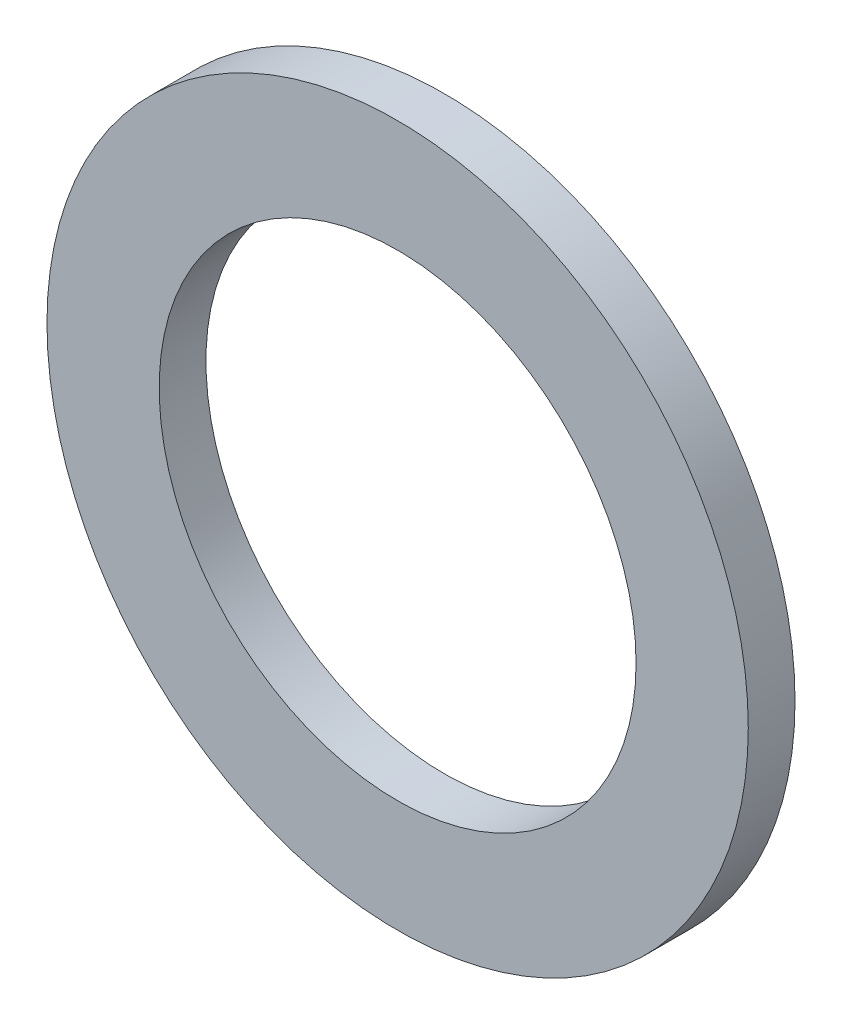
from build123d import *

# Parameters (mm, degrees)
ESQUISSE1_R        = 7.5
ESQUISSE1_R_2      = 5.1
BOSS_EXTRU_1_DEPTH = 1


with BuildPart() as part:
    # Esquisse1 → Boss.-Extru.1 (new body)
    with BuildSketch(Plane.XY):
        Circle(ESQUISSE1_R)
        Circle(ESQUISSE1_R_2, mode=Mode.SUBTRACT)
    extrude(amount=BOSS_EXTRU_1_DEPTH)


solid = part.part
